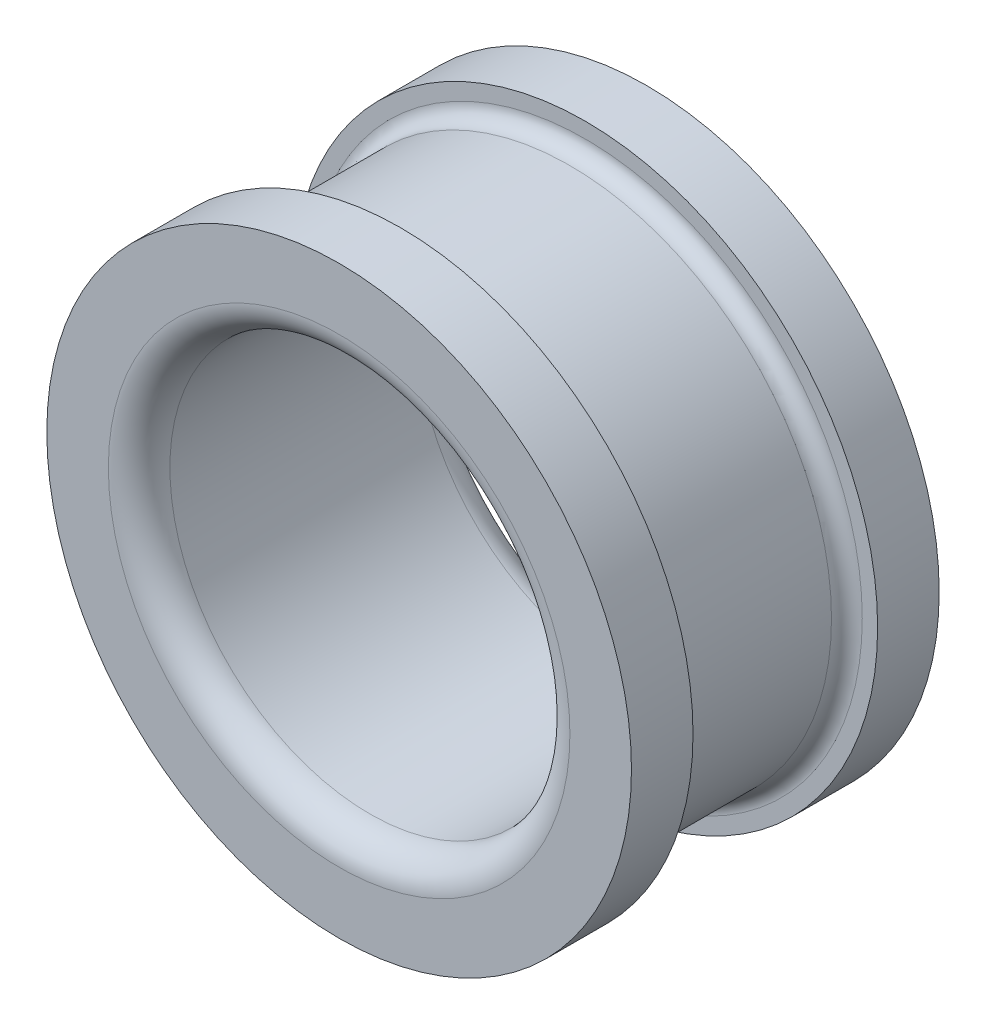
from build123d import *

# Parameters (mm, degrees)
SKETCH1_R               = 9.5
BOSS_EXTRUDE1_DEPTH     = 2
SKETCH2_R               = 8.5
BOSS_EXTRUDE2_DEPTH     = 6
SKETCH3_R               = 9.5
BOSS_EXTRUDE3_DEPTH     = 2
CUT_EXTRUDE1_DEPTH      = 17.748134224
CUT_EXTRUDE1_DEPTH_BACK = 17.748134224
SKETCH4_R               = 6.5
FILLET1_R               = 1
FILLET2_R               = 0.5


with BuildPart() as part:
    # Sketch1 → Boss-Extrude1 (new body)
    with BuildSketch(Plane.XY):
        Circle(SKETCH1_R)
    extrude(amount=BOSS_EXTRUDE1_DEPTH)

    # Sketch2 → Boss-Extrude2 (add)
    with BuildSketch(Plane.XY.offset(2)):
        Circle(SKETCH2_R)
    extrude(amount=BOSS_EXTRUDE2_DEPTH)

    # Sketch3 → Boss-Extrude3 (add)
    with BuildSketch(Plane.XY.offset(8)):
        Circle(SKETCH3_R)
    extrude(amount=BOSS_EXTRUDE3_DEPTH)

    # Sketch4 → Cut-Extrude1 (cut, two sides: drawn at the far end of the back side and taken through both)
    with BuildSketch(Plane(origin=(0, 0, 0), x_dir=(-1, 0, 0), z_dir=(0, 0, -1)).offset(-CUT_EXTRUDE1_DEPTH_BACK)):
        Circle(SKETCH4_R)
    extrude(amount=CUT_EXTRUDE1_DEPTH + CUT_EXTRUDE1_DEPTH_BACK, mode=Mode.SUBTRACT)

    # Fillet1
    fillet1_edges = [part.edges().sort_by_distance(p)[0] for p in [
        (6.5, 0, 10),
        (6.5, 0, 0),
    ]]
    fillet(fillet1_edges, radius=FILLET1_R)

    # Fillet2
    fillet2_edges = [part.edges().sort_by_distance(p)[0] for p in [
        (-8.5, 0, 2),
        (-8.5, 0, 8),
    ]]
    fillet(fillet2_edges, radius=FILLET2_R)


solid = part.part
